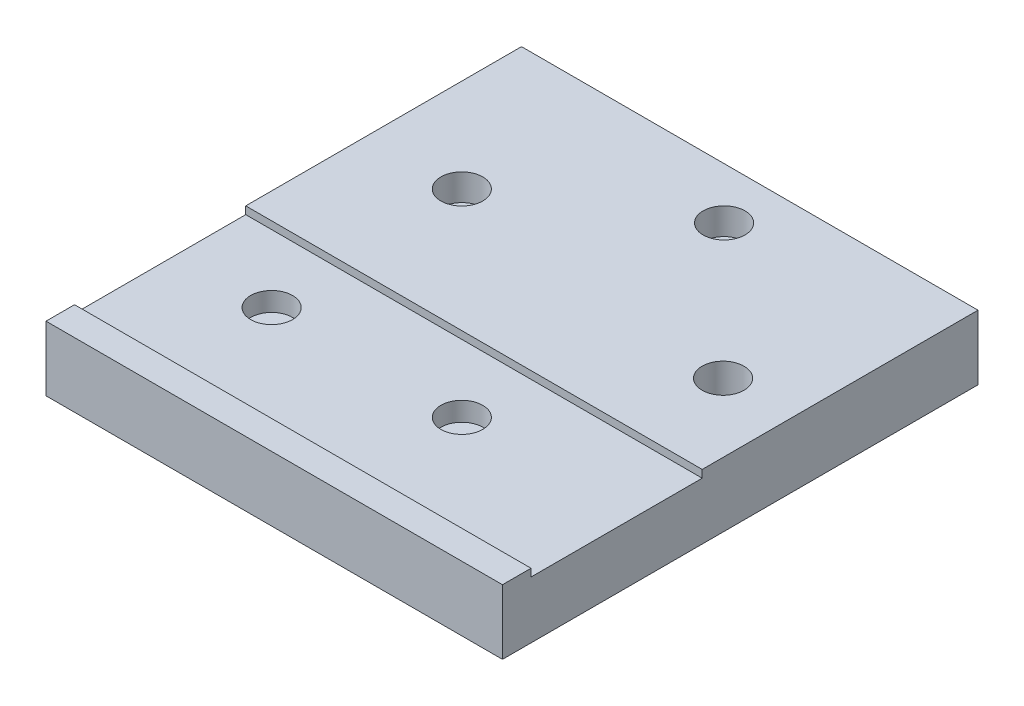
from build123d import *

# Parameters (mm, degrees)
SKETCH1_W           = 120
SKETCH1_H           = 55
BOSS_EXTRUDE1_DEPTH = 5
SKETCH2_W           = 120
SKETCH2_H           = 7.5
BOSS_EXTRUDE2_DEPTH = 20
SKETCH3_W           = 120
SKETCH3_H           = 2.5
BOSS_EXTRUDE4_DEPTH = 20
BOSS_EXTRUDE5_DEPTH = 190
SKETCH9_W           = 310
SKETCH9_H           = 25
BOSS_EXTRUDE6_DEPTH = 70
SKETCH14_R          = 5.5
CUT_EXTRUDE5_DEPTH  = 153
SKETCH15_W          = 125
SKETCH15_H          = 25
CUT_EXTRUDE6_DEPTH  = 190
SKETCH16_W          = 120
SKETCH16_H          = 125
BOSS_EXTRUDE8_DEPTH = 10
SKETCH17_W          = 120
SKETCH17_H          = 125
CUT_EXTRUDE7_DEPTH  = 18
CUT_EXTRUDE8_START  = -18
SKETCH18_R          = 5.5
CUT_EXTRUDE8_DEPTH  = 18


with BuildPart() as part:
    # Sketch1 → Boss-Extrude1 (new body)
    with BuildSketch(Plane(origin=(0, 0, 0), x_dir=(1, 0, 0), z_dir=(0, 1, 0))):
        Rectangle(SKETCH1_W, SKETCH1_H)
    extrude(amount=BOSS_EXTRUDE1_DEPTH)

    # Sketch2 → Boss-Extrude2 (add)
    with BuildSketch(Plane(origin=(0, 5, 0), x_dir=(1, 0, 0), z_dir=(0, 1, 0))):
        with Locations((0, -23.75)):
            Rectangle(SKETCH2_W, SKETCH2_H)
    extrude(amount=BOSS_EXTRUDE2_DEPTH)

    # Sketch3 → Boss-Extrude4 (add)
    with BuildSketch(Plane(origin=(0, 5, 0), x_dir=(1, 0, 0), z_dir=(0, 1, 0))):
        with Locations((0, 26.25)):
            Rectangle(SKETCH3_W, SKETCH3_H)
    extrude(amount=BOSS_EXTRUDE4_DEPTH)

    # Sketch8 → Boss-Extrude5 (add)
    with BuildSketch(Plane.ZY.offset(60)):
        Polygon((-27.5, 0), (-27.5, 25), (-25, 25), (-25, 5), (20, 5), (20, 25), (27.5, 25), (27.5, 0), align=None)
    extrude(amount=BOSS_EXTRUDE5_DEPTH)

    # Sketch9 → Boss-Extrude6 (add)
    with BuildSketch(Plane(origin=(0, 0, -27.5), x_dir=(-1, 0, 0), z_dir=(0, 0, -1))):
        with Locations((95, 12.5)):
            Rectangle(SKETCH9_W, SKETCH9_H)
    extrude(amount=BOSS_EXTRUDE6_DEPTH)

    # Sketch14 → Cut-Extrude5 (cut)
    with BuildSketch(Plane(origin=(0, 0, 0), x_dir=(-1, 0, 0), z_dir=(0, -1, 0))):
        with Locations(Location((225.445279058, 7.255161462, 0), (0, 0, 90))):
            Circle(SKETCH14_R)
        with Locations(Location((175.445279058, 7.255161462, 0), (0, 0, 90))):
            Circle(SKETCH14_R)
        with Locations(Location((225.445279058, 57.255161462, 0), (0, 0, 90))):
            Circle(SKETCH14_R)
        with Locations(Location((148.0182107, 48.5, 0), (0, 0, 90))):
            Circle(SKETCH14_R)
        with Locations(Location((183.240850763, 83.987541856, 0), (0, 0, 90))):
            Circle(SKETCH14_R)
    extrude(amount=-CUT_EXTRUDE5_DEPTH, mode=Mode.SUBTRACT)

    # Sketch15 → Cut-Extrude6 (cut)
    with BuildSketch(Plane(origin=(60, 0, 0), x_dir=(0, 0, -1), z_dir=(1, 0, 0))):
        with Locations((35, 12.5)):
            Rectangle(SKETCH15_W, SKETCH15_H)
    extrude(amount=-CUT_EXTRUDE6_DEPTH, mode=Mode.SUBTRACT)

    # Sketch16 → Boss-Extrude8 (add)
    with BuildSketch(Plane(origin=(0, 0, 0), x_dir=(-1, 0, 0), z_dir=(0, -1, 0))):
        with Locations((190, 35)):
            Rectangle(SKETCH16_W, SKETCH16_H)
    extrude(amount=BOSS_EXTRUDE8_DEPTH)

    # Sketch17 → Cut-Extrude7 (cut)
    with BuildSketch(Plane(origin=(0, 25, 0), x_dir=(1, 0, 0), z_dir=(0, 1, 0))):
        with Locations((-190, 35)):
            Rectangle(SKETCH17_W, SKETCH17_H)
    extrude(amount=-CUT_EXTRUDE7_DEPTH, mode=Mode.SUBTRACT)

    # Sketch18 → Cut-Extrude8 (cut)
    with BuildSketch(Plane(origin=(0, 7, 0), x_dir=(1, 0, 0), z_dir=(0, 1, 0)).offset(CUT_EXTRUDE8_START)):
        with Locations(Location((-148.0182107, 48.5, 0), (0, 0, 270))):
            Circle(SKETCH18_R)
    extrude(amount=CUT_EXTRUDE8_DEPTH, mode=Mode.SUBTRACT)


solid = part.part
